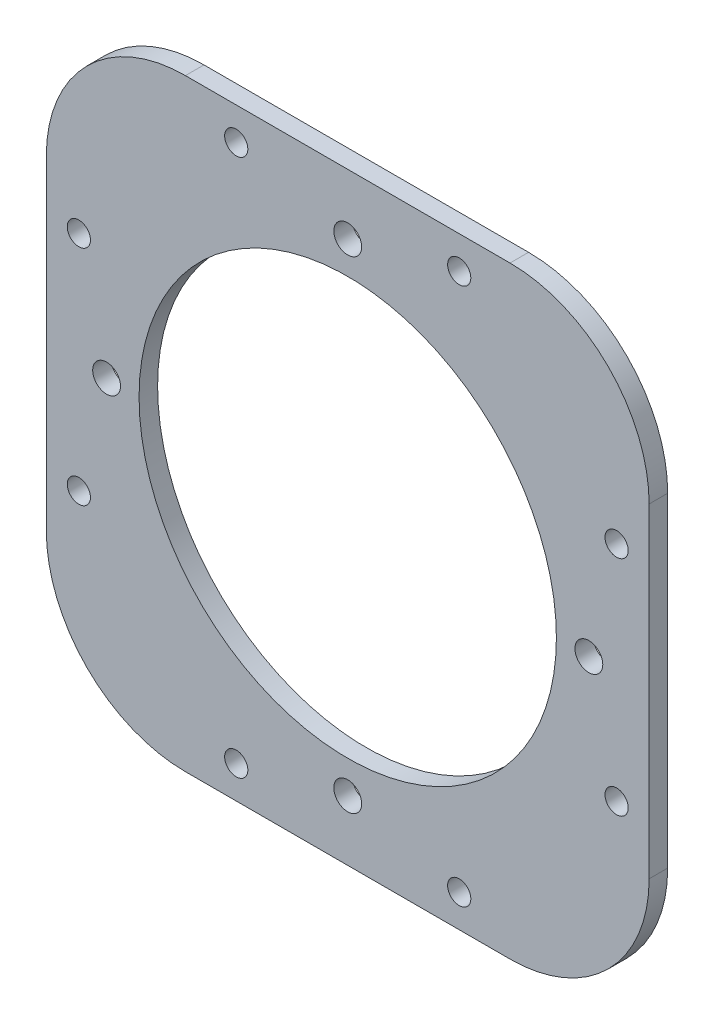
from build123d import *

# Parameters (mm, degrees)
CROQUIS1_W              = 65
CROQUIS1_H              = 65
CROQUIS1_R              = 22.5
CROQUIS1_R_2            = 1.5
CROQUIS1_R_3            = 1.25
SALIENTE_EXTRUIR1_DEPTH = 2
REDONDEO1_R             = 15


with BuildPart() as part:
    # Croquis1 → Saliente-Extruir1 (new body)
    with BuildSketch(Plane.XY):
        Rectangle(CROQUIS1_W, CROQUIS1_H)
        Circle(CROQUIS1_R, mode=Mode.SUBTRACT)
        with Locations((0, 26)):
            Circle(CROQUIS1_R_2, mode=Mode.SUBTRACT)
        with Locations((26, 0)):
            Circle(CROQUIS1_R_2, mode=Mode.SUBTRACT)
        with Locations((0, -26)):
            Circle(CROQUIS1_R_2, mode=Mode.SUBTRACT)
        with Locations((-26, 0)):
            Circle(CROQUIS1_R_2, mode=Mode.SUBTRACT)
        with Locations((12.02081528, 28.991378029)):
            Circle(CROQUIS1_R_3, mode=Mode.SUBTRACT)
        with Locations(Location((28.991378029, 12.02081528, 0), (0, 0, 180))):
            Circle(CROQUIS1_R_3, mode=Mode.SUBTRACT)
        with Locations(Location((12.02081528, -28.991378029, 0), (0, 0, 180))):
            Circle(CROQUIS1_R_3, mode=Mode.SUBTRACT)
        with Locations((28.991378029, -12.02081528)):
            Circle(CROQUIS1_R_3, mode=Mode.SUBTRACT)
        with Locations(Location((-28.991378029, -12.02081528, 0), (0, 0, 180))):
            Circle(CROQUIS1_R_3, mode=Mode.SUBTRACT)
        with Locations((-12.02081528, -28.991378029)):
            Circle(CROQUIS1_R_3, mode=Mode.SUBTRACT)
        with Locations(Location((-12.02081528, 28.991378029, 0), (0, 0, 180))):
            Circle(CROQUIS1_R_3, mode=Mode.SUBTRACT)
        with Locations((-28.991378029, 12.02081528)):
            Circle(CROQUIS1_R_3, mode=Mode.SUBTRACT)
    extrude(amount=SALIENTE_EXTRUIR1_DEPTH)

    # Redondeo1
    redondeo1_edges = [part.edges().sort_by_distance(p)[0] for p in [
        (-32.5, 32.5, 1),
        (32.5, 32.5, 1),
        (32.5, -32.5, 1),
        (-32.5, -32.5, 1),
    ]]
    fillet(redondeo1_edges, radius=REDONDEO1_R)


solid = part.part
